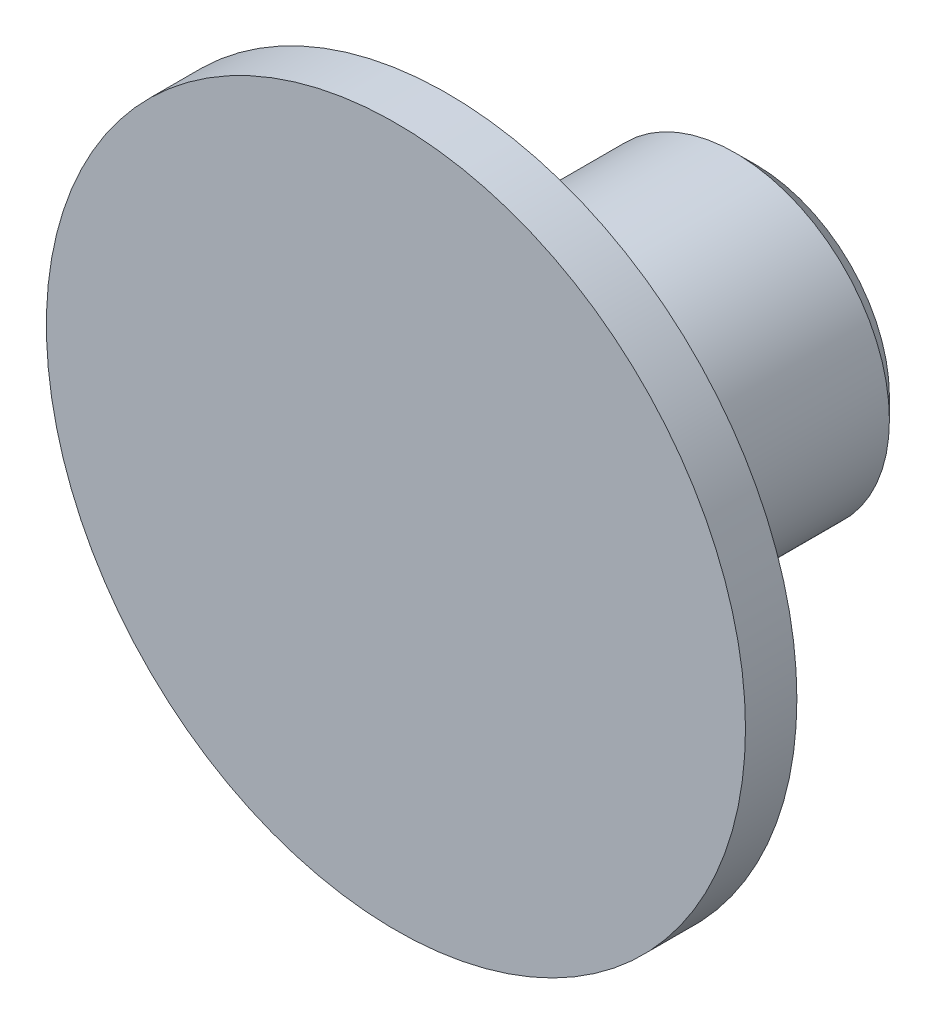
from build123d import *

# Parameters (mm, degrees)
SKETCH_1_R      = 15
EXTRUDE_1_DEPTH = 30
SKETCH_2_R      = 34
EXTRUDE_2_DEPTH = 5
CHAMFER_1_SIZE  = 2


with BuildPart() as part:
    # 草图1 → 凸台-拉伸1 (new body)
    with BuildSketch(Plane.XY):
        Circle(SKETCH_1_R)
    extrude(amount=EXTRUDE_1_DEPTH)

    # 草图2 → 凸台-拉伸2 (add)
    with BuildSketch(Plane.XY.offset(30)):
        Circle(SKETCH_2_R)
    extrude(amount=EXTRUDE_2_DEPTH)

    # 倒角1
    chamfer_1_edges = [part.edges().sort_by_distance(p)[0] for p in [
        (-15, 0, 0),
    ]]
    chamfer(chamfer_1_edges, length=CHAMFER_1_SIZE)


solid = part.part
